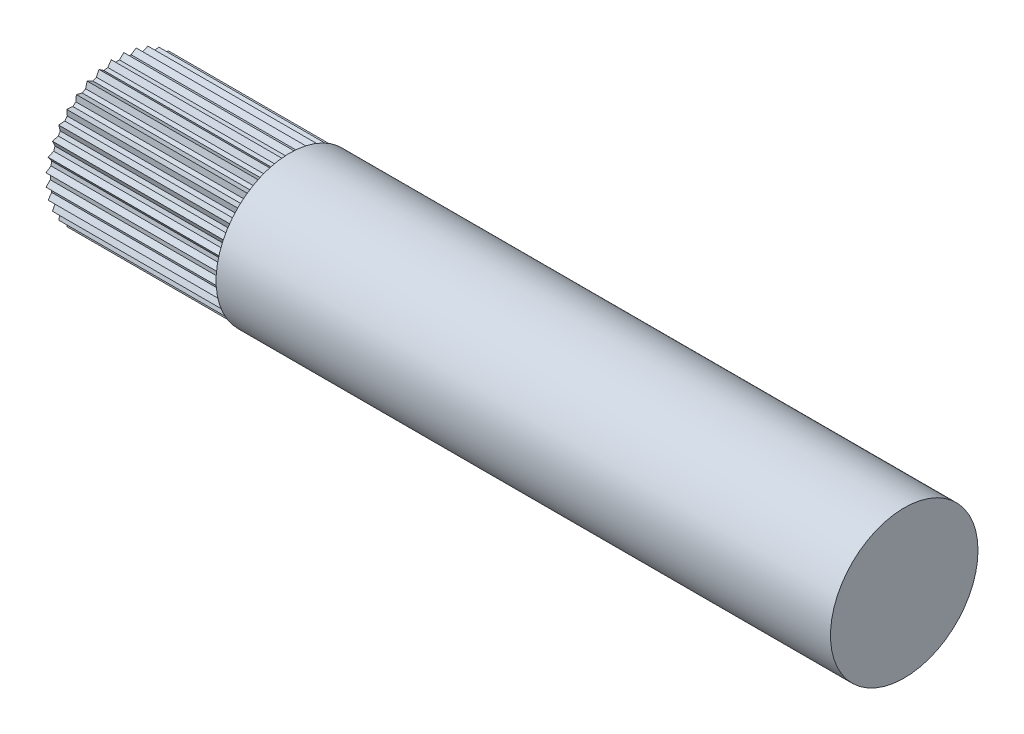
from build123d import *

# Parameters (mm, degrees)
SKETCH1_W           = 120.675
SKETCH1_H           = 1.5875
SKETCH6_R           = 7.9375
BOSS_EXTRUDE1_DEPTH = 101.6
SKETCH7_R           = 23.308025585
CUT_EXTRUDE3_DEPTH  = 19.075
SKETCH4_R           = 12.7
CUT_EXTRUDE4_DEPTH  = 41.50106


with BuildPart() as part:
    # Sketch1 → Revolve1 (revolve)
    with BuildSketch(Plane(origin=(0, 0, 0), x_dir=(1, 0, 0), z_dir=(0, 1, 0))):
        with Locations((79.5875, 8.73125)):
            Rectangle(SKETCH1_W, SKETCH1_H)
    revolve(axis=Axis((157.324, 0, 0), (-1, 0, 0)))

    # Sketch6 → Boss-Extrude1 (add)
    with BuildSketch(Plane.ZY.offset(-19.25)):
        with Locations(Location((0, 0, 0), (0, 0, 180))):
            Circle(SKETCH6_R)
    extrude(amount=-BOSS_EXTRUDE1_DEPTH)

    # Sketch7 → Cut-Extrude3 (cut)
    with BuildSketch(Plane(origin=(120.85, 0, 0), x_dir=(0, 0, -1), z_dir=(1, 0, 0))):
        Circle(SKETCH7_R)
    extrude(amount=CUT_EXTRUDE3_DEPTH, mode=Mode.SUBTRACT)

    # Sketch4 → Cut-Extrude4 (cut)
    with BuildSketch(Plane(origin=(0, 0, 0), x_dir=(0, 0, -1), z_dir=(1, 0, 0))):
        Circle(SKETCH4_R)
        Polygon((-9.235721046, 0.808020891), (-8.681700155, 0.254), (-8.681700155, -0.254), (-9.235721046, -0.808020891), (-8.593912259, -1.257420242), (-8.505698985, -1.75770258), (-8.955098336, -2.399511367), (-8.245002688, -2.730634406), (-8.071256455, -3.207998257), (-8.402379494, -3.918093905), (-7.645572882, -4.120879625), (-7.391572882, -4.56082053), (-7.594358603, -5.317627141), (-6.813836213, -5.385914002), (-6.487300108, -5.775064579), (-6.555586968, -6.555586968), (-5.775064579, -6.487300108), (-5.385914002, -6.813836213), (-5.317627141, -7.594358603), (-4.56082053, -7.391572882), (-4.120879625, -7.645572882), (-3.918093905, -8.402379494), (-3.207998257, -8.071256455), (-2.730634406, -8.245002688), (-2.399511367, -8.955098336), (-1.75770258, -8.505698985), (-1.257420242, -8.593912259), (-0.808020891, -9.235721046), (-0.254, -8.681700155), (0.254, -8.681700155), (0.808020891, -9.235721046), (1.257420242, -8.593912259), (1.75770258, -8.505698985), (2.399511367, -8.955098336), (2.730634406, -8.245002688), (3.207998257, -8.071256455), (3.918093905, -8.402379494), (4.120879625, -7.645572882), (4.56082053, -7.391572882), (5.317627141, -7.594358603), (5.385914002, -6.813836213), (5.775064579, -6.487300108), (6.555586968, -6.555586968), (6.487300108, -5.775064579), (6.813836213, -5.385914002), (7.594358603, -5.317627141), (7.391572882, -4.56082053), (7.645572882, -4.120879625), (8.402379494, -3.918093905), (8.071256455, -3.207998257), (8.245002688, -2.730634406), (8.955098336, -2.399511367), (8.505698985, -1.75770258), (8.593912259, -1.257420242), (9.235721046, -0.808020891), (8.681700155, -0.254), (8.681700155, 0.254), (9.235721046, 0.808020891), (8.593912259, 1.257420242), (8.505698985, 1.75770258), (8.955098336, 2.399511367), (8.245002688, 2.730634406), (8.071256455, 3.207998257), (8.402379494, 3.918093905), (7.645572882, 4.120879625), (7.391572882, 4.56082053), (7.594358603, 5.317627141), (6.813836213, 5.385914002), (6.487300108, 5.775064579), (6.555586968, 6.555586968), (5.775064579, 6.487300108), (5.385914002, 6.813836213), (5.317627141, 7.594358603), (4.56082053, 7.391572882), (4.120879625, 7.645572882), (3.918093905, 8.402379494), (3.207998257, 8.071256455), (2.730634406, 8.245002688), (2.399511367, 8.955098336), (1.75770258, 8.505698985), (1.257420242, 8.593912259), (0.808020891, 9.235721046), (0.254, 8.681700155), (-0.254, 8.681700155), (-0.808020891, 9.235721046), (-1.257420242, 8.593912259), (-1.75770258, 8.505698985), (-2.399511367, 8.955098336), (-2.730634406, 8.245002688), (-3.207998257, 8.071256455), (-3.918093905, 8.402379494), (-4.120879625, 7.645572882), (-4.56082053, 7.391572882), (-5.317627141, 7.594358603), (-5.385914002, 6.813836213), (-5.775064579, 6.487300108), (-6.555586968, 6.555586968), (-6.487300108, 5.775064579), (-6.813836213, 5.385914002), (-7.594358603, 5.317627141), (-7.391572882, 4.56082053), (-7.645572882, 4.120879625), (-8.402379494, 3.918093905), (-8.071256455, 3.207998257), (-8.245002688, 2.730634406), (-8.955098336, 2.399511367), (-8.505698985, 1.75770258), (-8.593912259, 1.257420242), align=None, mode=Mode.SUBTRACT)
    extrude(amount=CUT_EXTRUDE4_DEPTH, mode=Mode.SUBTRACT)


solid = part.part
